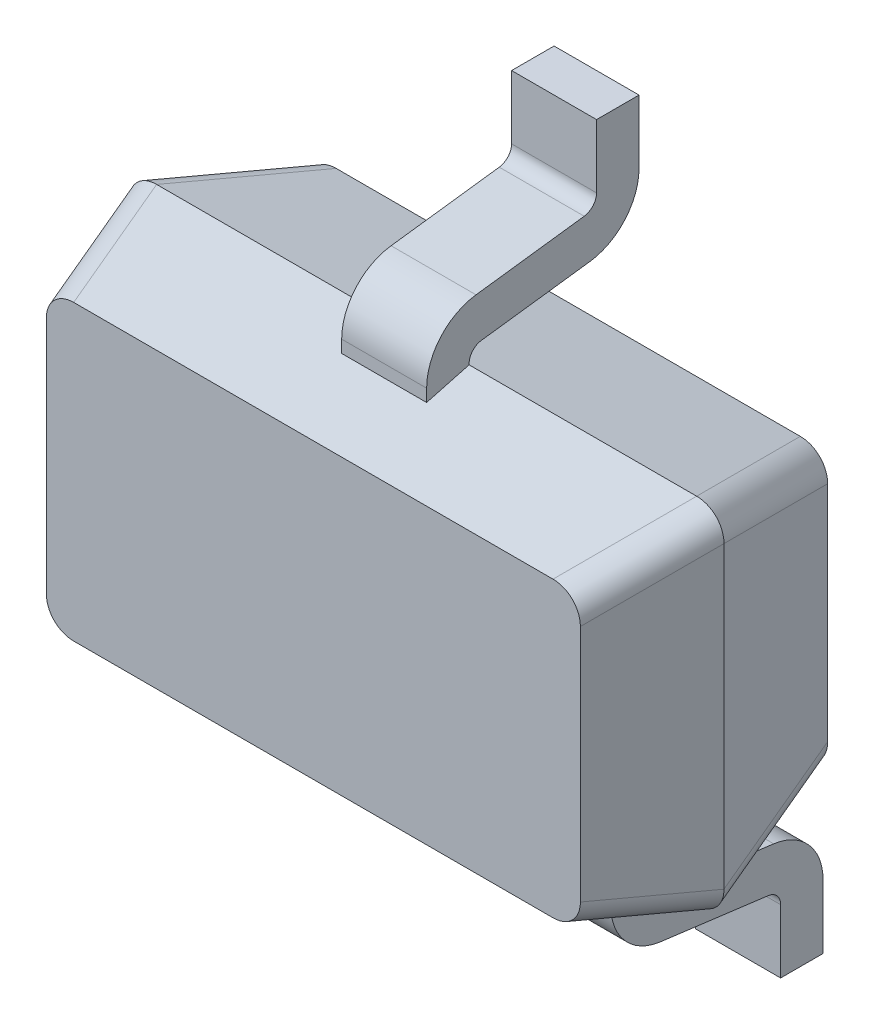
from build123d import *

# Parameters (mm, degrees)
EXTRUDE_START             = 0.6
SKETCH_1_W                = 2.1
SKETCH_1_H                = 1.25
EXTRUDE_1_DEPTH           = 0.4
EXTRUDE_1_TAPER           = 15
EXTRUDE_1_OTHER_WAY_DEPTH = 0.5
EXTRUDE_1_OTHER_WAY_TAPER = 15
EXTRUDE_START_2           = -0.15
EXTRUDE_4_DEPTH           = 0.3
EXTRUDE_START_3           = 0.65
EXTRUDE_5_DEPTH           = 0.15
PATTERN_LINEAR_2_COUNT    = 2
PATTERN_LINEAR_2_PITCH    = 1.3
FILLET_3_R                = 0.1


with BuildPart() as part:
    # Эскиз1 → Вытянуть1 (new body)
    with BuildSketch(Plane.XY.offset(EXTRUDE_START)):
        Rectangle(SKETCH_1_W, SKETCH_1_H)
    extrude(amount=EXTRUDE_1_DEPTH, taper=EXTRUDE_1_TAPER)

    # Эскиз1 → Вытянуть1 other way (add)
    with BuildSketch(Plane.XY.offset(EXTRUDE_START)):
        Rectangle(SKETCH_1_W, SKETCH_1_H)
    extrude(amount=-EXTRUDE_1_OTHER_WAY_DEPTH, taper=EXTRUDE_1_OTHER_WAY_TAPER)

    # Эскиз2 → Вытянуть4 (add)
    with BuildSketch(Plane(origin=(0, 0, 0), x_dir=(0, 0, -1), z_dir=(1, 0, 0)).offset(EXTRUDE_START_2)):
        with BuildLine():
            Line((-0.6, 0.55), (-0.75, 0.55))
            Line((-0.75, 0.55), (-0.75, 0.628617172))
            ThreePointArc((-0.75, 0.628617172), (-0.700198025, 0.760679859), (-0.575594468, 0.82697272))
            Line((-0.575594468, 0.82697272), (-0.193601383, 0.876262542))
            ThreePointArc((-0.193601383, 0.876262542), (-0.162450494, 0.892835757), (-0.15, 0.925851429))
            Line((-0.15, 0.925851429), (-0.15, 1.15))
            Line((-0.15, 1.15), (0, 1.15))
            Line((0, 1.15), (0, 0.925851429))
            ThreePointArc((0, 0.925851429), (-0.049801975, 0.793788742), (-0.174405532, 0.727495881))
            Line((-0.174405532, 0.727495881), (-0.556398617, 0.678206059))
            ThreePointArc((-0.556398617, 0.678206059), (-0.587549506, 0.661632844), (-0.6, 0.628617172))
            Line((-0.6, 0.628617172), (-0.6, 0.55))
        make_face()
    extrude(amount=EXTRUDE_4_DEPTH)

    # Эскиз2<4> → Вытянуть5 (add, symmetric)
    with BuildSketch(Plane(origin=(0, 0, 0), x_dir=(0, 0, -1), z_dir=(1, 0, 0)).offset(EXTRUDE_START_3)):
        with BuildLine():
            ThreePointArc((-0.6, -0.628617172), (-0.587549506, -0.661632844), (-0.556398617, -0.678206059))
            Line((-0.556398617, -0.678206059), (-0.174405532, -0.727495881))
            ThreePointArc((-0.174405532, -0.727495881), (-0.049801975, -0.793788742), (0, -0.925851429))
            Line((0, -0.925851429), (0, -1.15))
            Line((0, -1.15), (-0.15, -1.15))
            Line((-0.15, -1.15), (-0.15, -0.925851429))
            ThreePointArc((-0.15, -0.925851429), (-0.162450494, -0.892835757), (-0.193601383, -0.876262542))
            Line((-0.193601383, -0.876262542), (-0.575594468, -0.82697272))
            ThreePointArc((-0.575594468, -0.82697272), (-0.700198025, -0.760679859), (-0.75, -0.628617172))
            Line((-0.75, -0.628617172), (-0.75, -0.55))
            Line((-0.75, -0.55), (-0.6, -0.55))
            Line((-0.6, -0.55), (-0.6, -0.628617172))
        make_face()
    extrude_5 = extrude(amount=EXTRUDE_5_DEPTH, both=True)

    # Линейный массив2: Вытянуть5 ×2
    with Locations(*[(-i * PATTERN_LINEAR_2_PITCH, 0, 0) for i in range(1, PATTERN_LINEAR_2_COUNT)]):
        add(extrude_5)

    # Скругление3
    fillet_3_edges = [part.edges().sort_by_distance(p)[0] for p in [
        (0.996410162, -0.571410162, 0.8),
        (0.996410162, 0.571410162, 0.8),
        (-0.996410162, 0.571410162, 0.8),
        (-0.996410162, -0.571410162, 0.8),
        (0.983012702, -0.558012702, 0.35),
        (-0.983012702, -0.558012702, 0.35),
        (-0.983012702, 0.558012702, 0.35),
        (0.983012702, 0.558012702, 0.35),
    ]]
    fillet(fillet_3_edges, radius=FILLET_3_R)


solid = part.part
